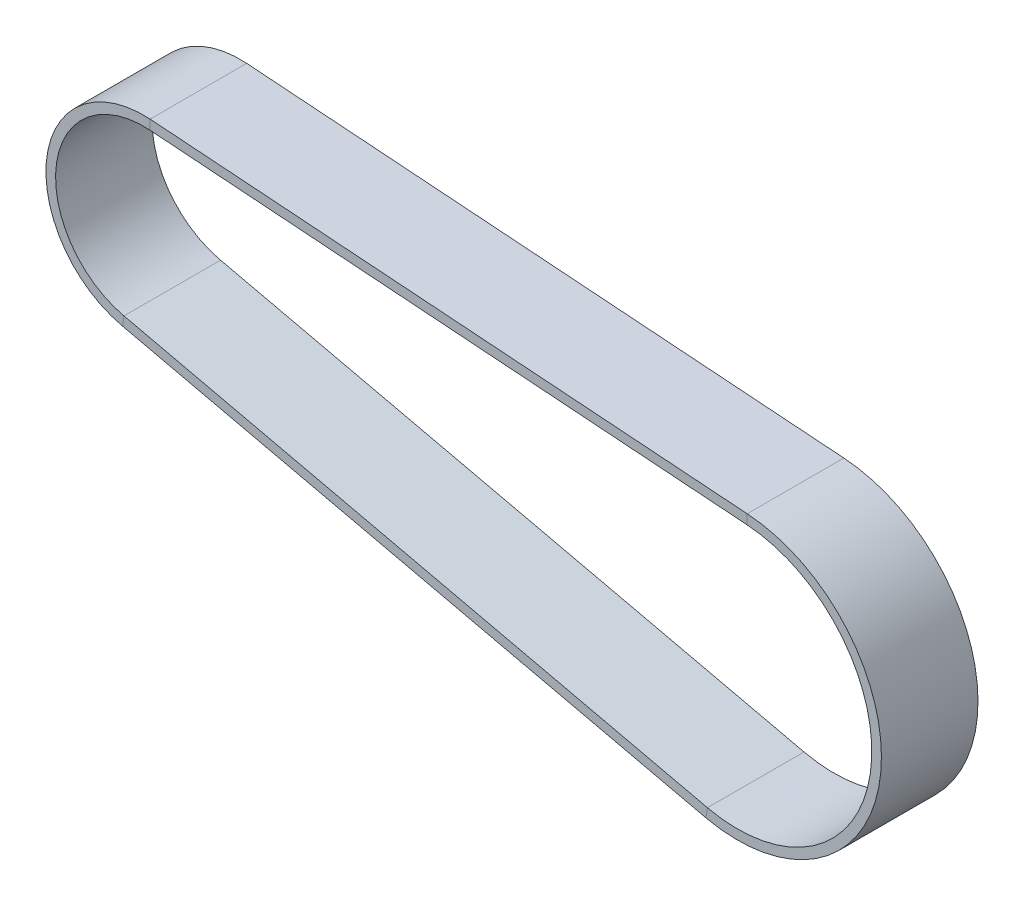
from build123d import *

# Parameters (mm, degrees)
CROQUIS3_W = 10
CROQUIS3_H = 1


with BuildPart() as part:
    # Barrer1: sweep along a path in Croquis2
    with BuildLine(Plane.XY) as barrer1_path:
        Line((0.659407884, 9.106156228), (62.491462424, 4.628685909))
        ThreePointArc((62.491462424, 4.628685909), (75.23778781, -11.306375083), (58.370917042, -22.79130652))
        Line((58.370917042, -22.79130652), (-2.046135399, -8.897765446))
        ThreePointArc((-2.046135399, -8.897765446), (-9.028624048, 1.356778461), (0.659407884, 9.106156228))
    # Croquis3 → Barrer1 (sweep)
    with BuildSketch(Plane(origin=(0.659407884, 0, 0), x_dir=(0, 0, -1), z_dir=(1, 0, 0))):
        with Locations((0, 9.606156228)):
            Rectangle(CROQUIS3_W, CROQUIS3_H)
    sweep(path=barrer1_path.line)


solid = part.part
